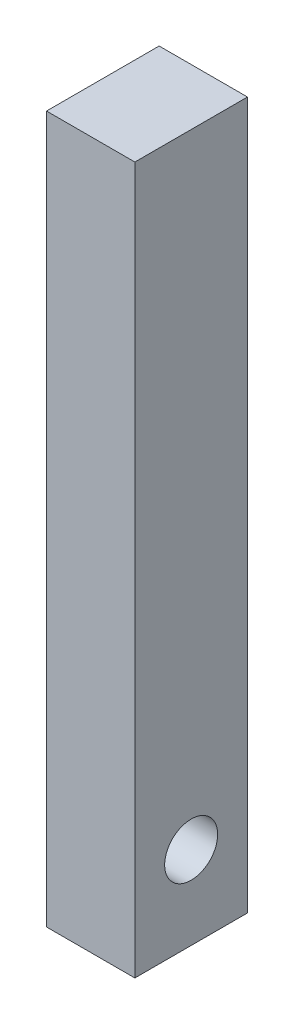
from build123d import *

# Parameters (mm, degrees)
SKIZZE1_W                       = 10
SKIZZE1_H                       = 80
AUFSATZ_LINEAR_AUSTRAGEN1_DEPTH = 12.75
F_6_0_6_DURCHMESSER_BOHRUNG1_D  = 6


with BuildPart() as part:
    # Skizze1 → Aufsatz-Linear austragen1 (new body)
    with BuildSketch(Plane.XY):
        with Locations((-10.949316523, -25.997467638)):
            Rectangle(SKIZZE1_W, SKIZZE1_H)
    extrude(amount=AUFSATZ_LINEAR_AUSTRAGEN1_DEPTH)

    # Ø6.0 (6) Durchmesser Bohrung1 (through all)
    with Locations(Plane(origin=(-5.949316523, 0, 0), x_dir=(0, 0, -1), z_dir=(1, 0, 0))):
        with Locations((-6.375, -56.597467638)):
            Hole(F_6_0_6_DURCHMESSER_BOHRUNG1_D / 2)


solid = part.part
